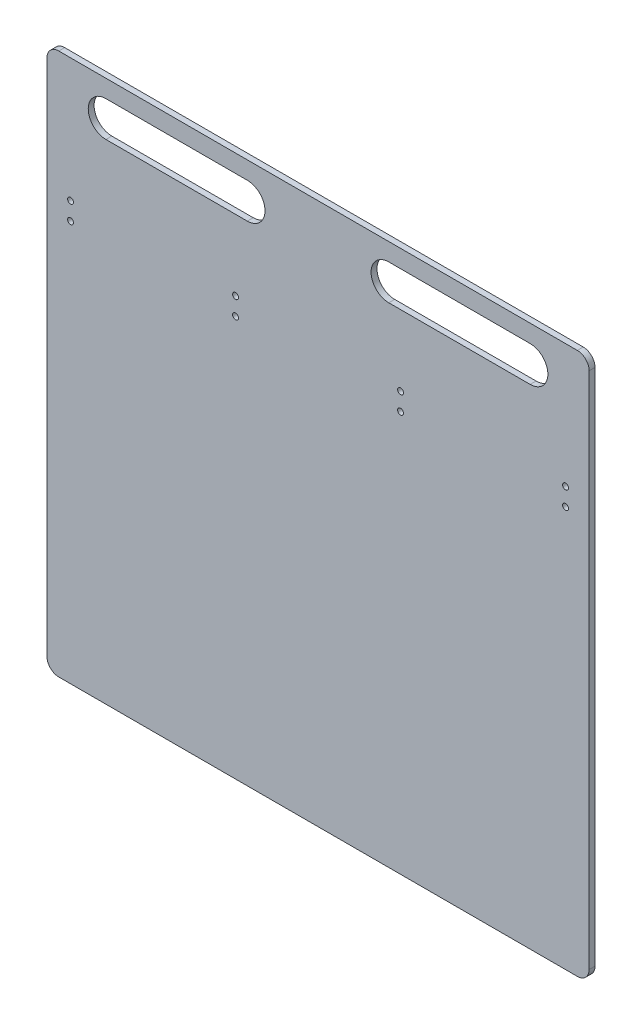
from build123d import *

# Parameters (mm, degrees)
SKETCH1_W           = 584.2
SKETCH1_H           = 584.2
SKETCH1_R           = 3.175
BOSS_EXTRUDE1_DEPTH = 6.35
FILLET1_R           = 12.7


with BuildPart() as part:
    # Sketch1 → Boss-Extrude1 (new body)
    with BuildSketch(Plane.XY):
        Rectangle(SKETCH1_W, SKETCH1_H)
        with Locations((-266.7, 139.7)):
            Circle(SKETCH1_R, mode=Mode.SUBTRACT)
        with Locations((-88.9, 139.7)):
            Circle(SKETCH1_R, mode=Mode.SUBTRACT)
        with Locations((88.9, 139.7)):
            Circle(SKETCH1_R, mode=Mode.SUBTRACT)
        with Locations((266.7, 139.7)):
            Circle(SKETCH1_R, mode=Mode.SUBTRACT)
        with Locations((-88.9, 158.75)):
            Circle(SKETCH1_R, mode=Mode.SUBTRACT)
        with Locations((88.9, 158.75)):
            Circle(SKETCH1_R, mode=Mode.SUBTRACT)
        with Locations((266.7, 158.75)):
            Circle(SKETCH1_R, mode=Mode.SUBTRACT)
        with Locations((-266.7, 158.75)):
            Circle(SKETCH1_R, mode=Mode.SUBTRACT)
        with BuildLine():
            Line((-228.6, 273.05), (-76.2, 273.05))
            ThreePointArc((-76.2, 273.05), (-57.15, 254), (-76.2, 234.95))
            Line((-76.2, 234.95), (-228.6, 234.95))
            ThreePointArc((-228.6, 234.95), (-247.65, 254), (-228.6, 273.05))
        make_face(mode=Mode.SUBTRACT)
        with BuildLine():
            Line((76.2, 273.05), (228.6, 273.05))
            ThreePointArc((228.6, 273.05), (247.65, 254), (228.6, 234.95))
            Line((228.6, 234.95), (76.2, 234.95))
            ThreePointArc((76.2, 234.95), (57.15, 254), (76.2, 273.05))
        make_face(mode=Mode.SUBTRACT)
    extrude(amount=BOSS_EXTRUDE1_DEPTH)

    # Fillet1
    fillet1_edges = [part.edges().sort_by_distance(p)[0] for p in [
        (292.1, -292.1, 3.175),
        (-292.1, -292.1, 3.175),
        (-292.1, 292.1, 3.175),
        (292.1, 292.1, 3.175),
    ]]
    fillet(fillet1_edges, radius=FILLET1_R)


solid = part.part
